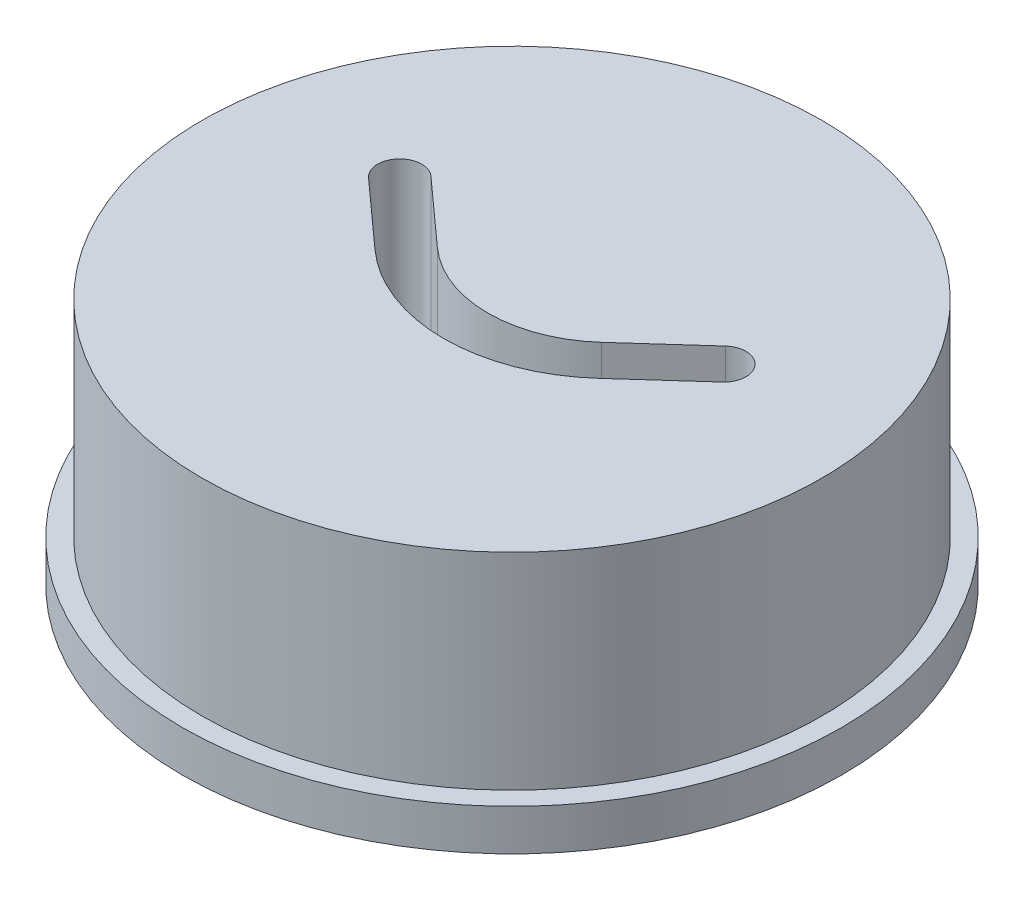
from build123d import *

# Parameters (mm, degrees)
SKETCH2_R           = 23.876
BOSS_EXTRUDE1_DEPTH = 19.05
CUT_EXTRUDE2_DEPTH  = 12.7
SKETCH15_R          = 25.4
BOSS_EXTRUDE2_DEPTH = 3.175


with BuildPart() as part:
    # Sketch2 → Boss-Extrude1 (new body)
    with BuildSketch(Plane(origin=(0, 0, 0), x_dir=(1, 0, 0), z_dir=(0, 1, 0))):
        with Locations(Location((0, 0, 0), (0, 0, 90))):
            Circle(SKETCH2_R)
        with BuildLine():
            Line((-13.081, 3.175), (-8.059107313, -1.349826056))
            ThreePointArc((-8.059107313, -1.349826056), (0, -4.445), (8.059107313, -1.349826056))
            Line((8.059107313, -1.349826056), (13.081, 3.175))
            ThreePointArc((13.081, 3.175), (13.146371637, 4.430535164), (11.890836473, 4.495906802))
            Line((11.890836473, 4.495906802), (6.868943786, -0.028919255))
            ThreePointArc((6.868943786, -0.028919255), (0, -2.667), (-6.868943786, -0.028919255))
            Line((-6.868943786, -0.028919255), (-11.890836473, 4.495906802))
            ThreePointArc((-11.890836473, 4.495906802), (-13.146371637, 4.430535164), (-13.081, 3.175))
        make_face(mode=Mode.SUBTRACT)
    extrude(amount=BOSS_EXTRUDE1_DEPTH)

    # Sketch14 → Cut-Extrude2 (cut)
    with BuildSketch(Plane(origin=(0, 19.05, 0), x_dir=(1, 0, 0), z_dir=(0, 1, 0))):
        with BuildLine():
            Line((8.603182068, -1.953669166), (13.625074755, 2.571156891))
            ThreePointArc((13.625074755, 2.571156891), (13.750214746, 4.97460992), (11.346761717, 5.099749911))
            Line((11.346761717, 5.099749911), (6.32486903, 0.574923855))
            ThreePointArc((6.32486903, 0.574923855), (0, -1.8542), (-6.32486903, 0.574923855))
            Line((-6.32486903, 0.574923855), (-11.346761717, 5.099749911))
            ThreePointArc((-11.346761717, 5.099749911), (-13.750214746, 4.97460992), (-13.625074755, 2.571156891))
            Line((-13.625074755, 2.571156891), (-8.603182068, -1.953669166))
            ThreePointArc((-8.603182068, -1.953669166), (0, -5.2578), (8.603182068, -1.953669166))
        make_face()
    extrude(amount=-CUT_EXTRUDE2_DEPTH, mode=Mode.SUBTRACT)

    # Sketch15 → Boss-Extrude2 (add)
    with BuildSketch(Plane.XZ):
        with Locations(Location((0, 0, 0), (0, 0, 270))):
            Circle(SKETCH15_R)
        with BuildLine():
            Line((-6.868943786, 0.028919255), (-11.890836473, -4.495906802))
            ThreePointArc((-11.890836473, -4.495906802), (-13.146371637, -4.430535164), (-13.081, -3.175))
            Line((-13.081, -3.175), (-8.059107313, 1.349826056))
            ThreePointArc((-8.059107313, 1.349826056), (0, 4.445), (8.059107313, 1.349826056))
            Line((8.059107313, 1.349826056), (13.081, -3.175))
            ThreePointArc((13.081, -3.175), (13.146371637, -4.430535164), (11.890836473, -4.495906802))
            Line((11.890836473, -4.495906802), (6.868943786, 0.028919255))
            ThreePointArc((6.868943786, 0.028919255), (0, 2.667), (-6.868943786, 0.028919255))
        make_face(mode=Mode.SUBTRACT)
    extrude(amount=-BOSS_EXTRUDE2_DEPTH)


solid = part.part
